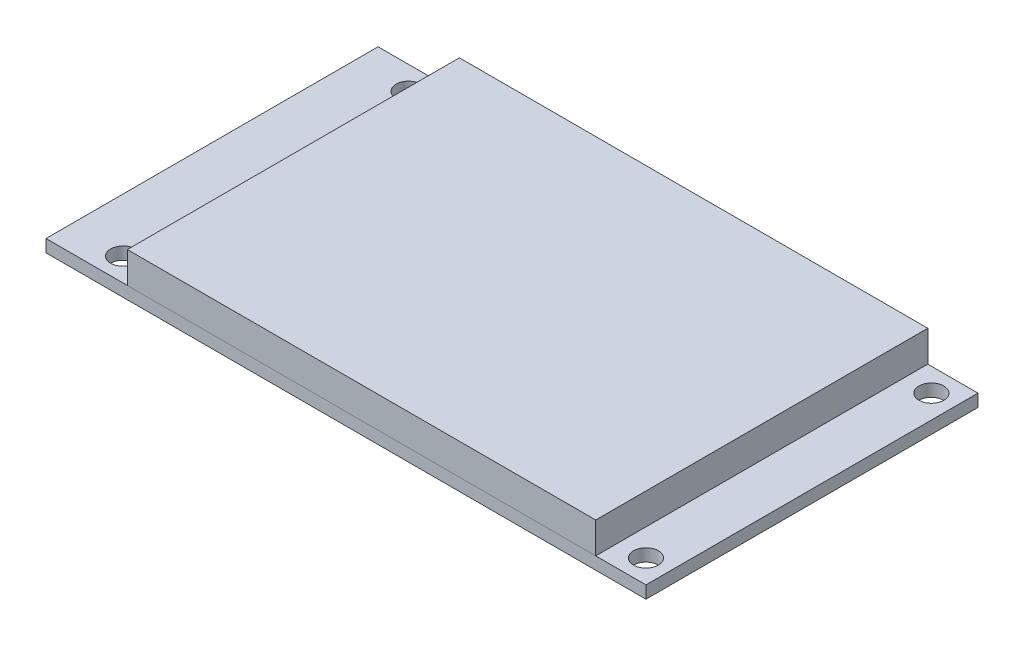
from build123d import *

# Parameters (mm, degrees)
SZKIC1_W                    = 77.18
SZKIC1_H                    = 42.72
SZKIC1_R                    = 1.6
DODANIE_WYCI_GNI_CIE1_DEPTH = 1.6
SZKIC2_W                    = 60.26
SZKIC2_H                    = 42.72
DODANIE_WYCI_GNI_CIE2_DEPTH = 4


with BuildPart() as part:
    # Szkic1 → Dodanie-wyciągnięcie1 (new body)
    with BuildSketch(Plane(origin=(0, 0, 0), x_dir=(1, 0, 0), z_dir=(0, 1, 0))):
        Rectangle(SZKIC1_W, SZKIC1_H)
        with Locations(Location((-31.67, 18.36, 0), (0, 0, 270))):
            Circle(SZKIC1_R, mode=Mode.SUBTRACT)
        with Locations(Location((35.59, 18.36, 0), (0, 0, 270))):
            Circle(SZKIC1_R, mode=Mode.SUBTRACT)
        with Locations(Location((35.59, -18.36, 0), (0, 0, 90))):
            Circle(SZKIC1_R, mode=Mode.SUBTRACT)
        with Locations(Location((-31.67, -18.36, 0), (0, 0, 90))):
            Circle(SZKIC1_R, mode=Mode.SUBTRACT)
    extrude(amount=DODANIE_WYCI_GNI_CIE1_DEPTH)


with BuildPart() as body_2:
    # Szkic2 → Dodanie-wyciągnięcie2 (new body)
    with BuildSketch(Plane(origin=(0, 1.6, 0), x_dir=(1, 0, 0), z_dir=(0, 1, 0))):
        with Locations((2, 0)):
            Rectangle(SZKIC2_W, SZKIC2_H)
    extrude(amount=DODANIE_WYCI_GNI_CIE2_DEPTH)


solid = Compound([part.part, body_2.part])
